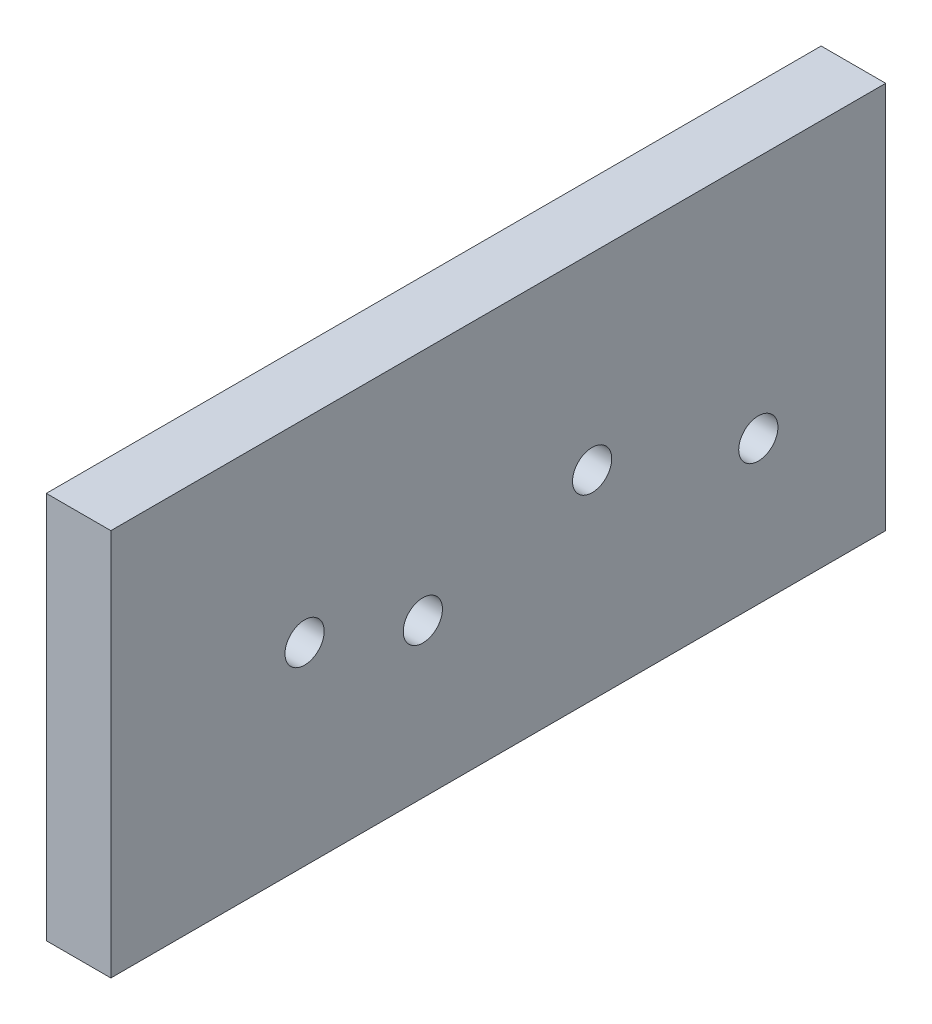
from build123d import *

# Parameters (mm, degrees)
SKETCH1_W                       = 152.4
SKETCH1_H                       = 76.2
SKETCH1_R                       = 3.854557775
BOSS_EXTRUDE1_DEPTH             = 12.7
F_1_4_0_25_DIAMETER_HOLE2_D     = 6.35
F_1_4_0_25_DIAMETER_HOLE2_DEPTH = 12.7
F_1_4_0_25_DIAMETER_HOLE2_TIP   = 1.907732465
SKETCH2_R                       = 7.9375
CUT_EXTRUDE1_DEPTH              = 6.35


with BuildPart() as part:
    # Sketch1 → Boss-Extrude1 (new body)
    with BuildSketch(Plane(origin=(0, 0, 0), x_dir=(0, 0, -1), z_dir=(1, 0, 0))):
        Rectangle(SKETCH1_W, SKETCH1_H)
        with Locations((18.457733582, 1.096077429)):
            Circle(SKETCH1_R, mode=Mode.SUBTRACT)
        with Locations((-38.1, 0)):
            Circle(SKETCH1_R, mode=Mode.SUBTRACT)
        with Locations((-14.836022013, -7.860160654)):
            Circle(SKETCH1_R, mode=Mode.SUBTRACT)
        with Locations((51.143457994, -9.873506971)):
            Circle(SKETCH1_R, mode=Mode.SUBTRACT)
    extrude(amount=BOSS_EXTRUDE1_DEPTH)

    # 1/4 (0.25) Diameter Hole2
    with Locations(Plane.XZ.offset(38.1)):
        with Locations((6.35, 57.15), (6.35, -63.5), (6.35, 0)):
            Hole(F_1_4_0_25_DIAMETER_HOLE2_D / 2, depth=F_1_4_0_25_DIAMETER_HOLE2_DEPTH)
            with Locations((0, 0, -(F_1_4_0_25_DIAMETER_HOLE2_DEPTH + F_1_4_0_25_DIAMETER_HOLE2_TIP / 2))):  # 118° drill point
                Cone(0, F_1_4_0_25_DIAMETER_HOLE2_D / 2, F_1_4_0_25_DIAMETER_HOLE2_TIP, mode=Mode.SUBTRACT)

    # Sketch2 → Cut-Extrude1 (cut)
    with BuildSketch(Plane.ZY):
        with Locations((38.1, 0)):
            Circle(SKETCH2_R)
        with Locations((14.836022013, -7.860160654)):
            Circle(SKETCH2_R)
        with Locations((-18.457733582, 1.096077429)):
            Circle(SKETCH2_R)
        with Locations((-51.143457994, -9.873506971)):
            Circle(SKETCH2_R)
    extrude(amount=-CUT_EXTRUDE1_DEPTH, mode=Mode.SUBTRACT)


solid = part.part
